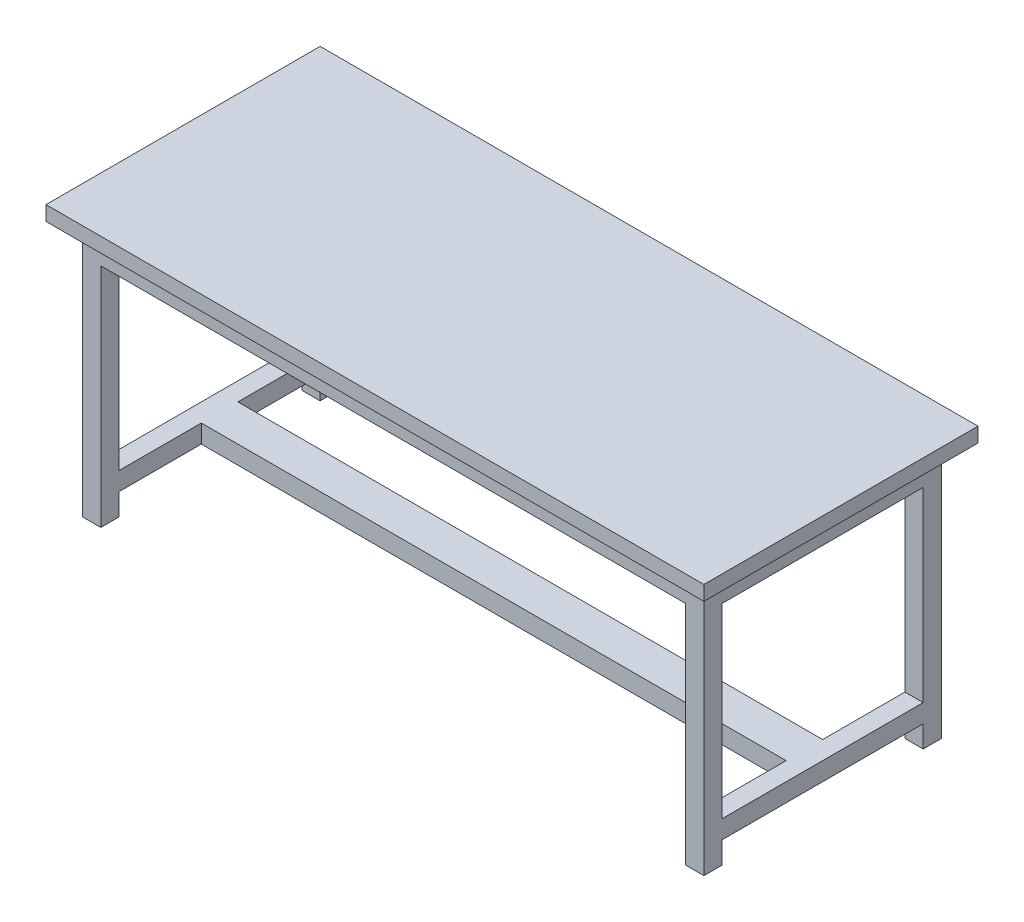
from build123d import *

# Parameters (mm, degrees)
SKETCH_1_W      = 1800
SKETCH_1_H      = 750
EXTRUDE_1_DEPTH = 40
SKETCH_2_W      = 50
SKETCH_2_H      = 50
EXTRUDE_2_DEPTH = 700
SKETCH_3_W      = 50
SKETCH_3_H      = 550
SKETCH_3_W_2    = 1600
SKETCH_3_H_2    = 50
EXTRUDE_3_DEPTH = 80
EXTRUDE_4_REACH = 2039.768
SKETCH_4_W      = 50
SKETCH_4_H      = 50
EXTRUDE_5_REACH = 1987.573
SKETCH_5_W      = 100
SKETCH_5_H      = 50


with BuildPart() as part:
    # ｽｹｯﾁ1 → ﾎﾞｽ - 押し出し1 (new body)
    with BuildSketch(Plane(origin=(0, 0, 0), x_dir=(1, 0, 0), z_dir=(0, 1, 0))):
        with Locations((900, 375)):
            Rectangle(SKETCH_1_W, SKETCH_1_H)
    extrude(amount=EXTRUDE_1_DEPTH)

    # ｽｹｯﾁ2 → ﾎﾞｽ - 押し出し2 (add)
    with BuildSketch(Plane(origin=(0, 0, 0), x_dir=(-1, 0, 0), z_dir=(0, -1, 0))):
        with Locations((-1725, 75)):
            Rectangle(SKETCH_2_W, SKETCH_2_H)
        with Locations((-1725, 675)):
            Rectangle(SKETCH_2_W, SKETCH_2_H)
        with Locations((-75, 75)):
            Rectangle(SKETCH_2_W, SKETCH_2_H)
        with Locations((-75, 675)):
            Rectangle(SKETCH_2_W, SKETCH_2_H)
    extrude(amount=EXTRUDE_2_DEPTH)

    # ｽｹｯﾁ3 → ﾎﾞｽ - 押し出し3 (add)
    with BuildSketch(Plane(origin=(0, 0, 0), x_dir=(-1, 0, 0), z_dir=(0, -1, 0))):
        with Locations((-1725, 375)):
            Rectangle(SKETCH_3_W, SKETCH_3_H)
        with Locations((-900, 675)):
            Rectangle(SKETCH_3_W_2, SKETCH_3_H_2)
        with Locations((-900, 75)):
            Rectangle(SKETCH_3_W_2, SKETCH_3_H_2)
        with Locations((-75, 375)):
            Rectangle(SKETCH_3_W, SKETCH_3_H)
    extrude(amount=EXTRUDE_3_DEPTH)

    # ｽｹｯﾁ4 → ﾎﾞｽ - 押し出し4 (add, up to next)
    with BuildSketch(Plane.XY.offset(-650), mode=Mode.PRIVATE) as extrude_4_sk1:
        with Locations((1725, -615)):
            Rectangle(SKETCH_4_W, SKETCH_4_H)
    extrude_4_tool1 = extrude(extrude_4_sk1.sketch, amount=EXTRUDE_4_REACH, mode=Mode.PRIVATE) - part.part
    # ｽｹｯﾁ4 → ﾎﾞｽ - 押し出し4 (add, up to next)
    with BuildSketch(Plane.XY.offset(-650), mode=Mode.PRIVATE) as extrude_4_sk2:
        with Locations((75, -615)):
            Rectangle(SKETCH_4_W, SKETCH_4_H)
    extrude_4_tool2 = extrude(extrude_4_sk2.sketch, amount=EXTRUDE_4_REACH, mode=Mode.PRIVATE) - part.part
    add(extrude_4_tool1.solids().sort_by_distance((1725, -615, -650))[0])
    add(extrude_4_tool2.solids().sort_by_distance((75, -615, -650))[0])

    # ｽｹｯﾁ5 → ﾎﾞｽ - 押し出し5 (add, up to next)
    with BuildSketch(Plane.ZY.offset(-1700), mode=Mode.PRIVATE) as extrude_5_sk1:
        with Locations((-375, -615)):
            Rectangle(SKETCH_5_W, SKETCH_5_H)
    extrude_5_tool1 = extrude(extrude_5_sk1.sketch, amount=EXTRUDE_5_REACH, mode=Mode.PRIVATE) - part.part
    add(extrude_5_tool1.solids().sort_by_distance((1700, -615, -375))[0])


solid = part.part
